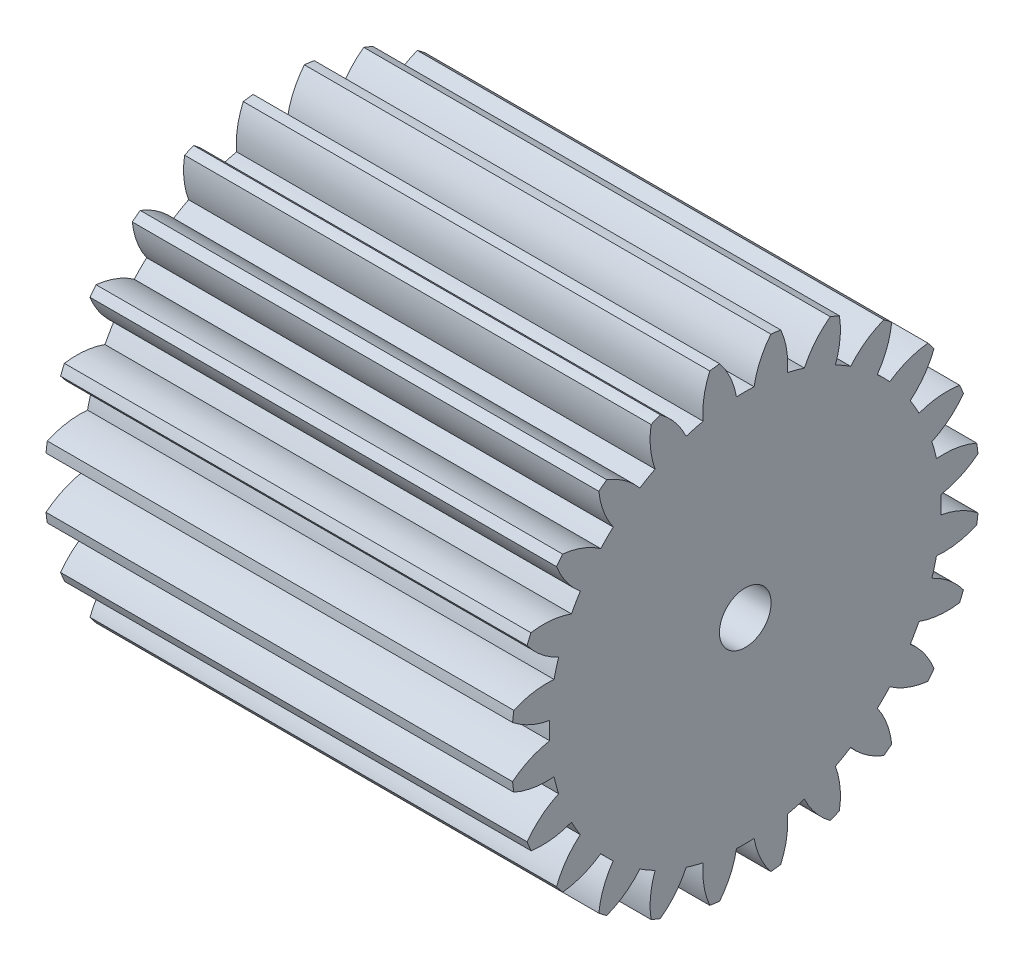
from build123d import *

# Parameters (mm, degrees)
SKETCH1_R           = 1.55
BOSS_EXTRUDE1_DEPTH = 28


with BuildPart() as part:
    # Sketch1 → Boss-Extrude1 (new body)
    with BuildSketch(Plane(origin=(-24.036200878, 0, 0), x_dir=(0, 0, -1), z_dir=(1, 0, 0))):
        with BuildLine():
            ThreePointArc((-20.45966069, 14.943685115), (-19.408744482, 14.297932757), (-18.23009109, 13.93434348))
            ThreePointArc((-18.23009109, 13.93434348), (-18.241981361, 13.405873993), (-18.23009109, 12.877404505))
            ThreePointArc((-18.23009109, 12.877404505), (-19.408744482, 12.513815228), (-20.45966069, 11.86806287))
            ThreePointArc((-20.45966069, 11.86806287), (-20.423843041, 11.571709606), (-20.381738364, 11.276184046))
            ThreePointArc((-20.381738364, 11.276184046), (-19.19949825, 10.924432295), (-17.966902668, 10.878289967))
            ThreePointArc((-17.966902668, 10.878289967), (-17.84160982, 10.364750213), (-17.693346732, 9.857365315))
            ThreePointArc((-17.693346732, 9.857365315), (-18.737734654, 9.201107096), (-19.585708752, 8.305361087))
            ThreePointArc((-19.585708752, 8.305361087), (-19.465117023, 8.00599622), (-19.337681897, 7.709479816))
            ThreePointArc((-19.337681897, 7.709479816), (-18.111776725, 7.700053845), (-16.921717322, 7.994487129))
            ThreePointArc((-16.921717322, 7.994487129), (-16.667779856, 7.530873993), (-16.393247835, 7.079151127))
            ThreePointArc((-16.393247835, 7.079151127), (-17.232196976, 6.17494688), (-17.81944093, 5.09025083))
            ThreePointArc((-17.81944093, 5.09025083), (-17.640245305, 4.851510199), (-17.456018805, 4.616629895))
            ThreePointArc((-17.456018805, 4.616629895), (-16.256292957, 4.903124001), (-15.165762707, 5.479461363))
            ThreePointArc((-15.165762707, 5.479461363), (-14.80048604, 5.097369314), (-14.418393991, 4.732092647))
            ThreePointArc((-14.418393991, 4.732092647), (-14.994731353, 3.641562397), (-15.281225459, 2.441836549))
            ThreePointArc((-15.281225459, 2.441836549), (-15.046345155, 2.257610049), (-14.807604524, 2.078414424))
            ThreePointArc((-14.807604524, 2.078414424), (-13.722908474, 2.665658378), (-12.818704227, 3.504607519))
            ThreePointArc((-12.818704227, 3.504607519), (-12.366981361, 3.230075498), (-11.903368225, 2.976138032))
            ThreePointArc((-11.903368225, 2.976138032), (-12.17781737, 1.773599613), (-12.144037527, 0.540603301))
            ThreePointArc((-12.144037527, 0.540603301), (-11.869479248, 0.423445663), (-11.592494266, 0.312146602))
            ThreePointArc((-11.592494266, 0.312146602), (-10.696748258, 1.1601207), (-10.040490039, 2.204508622))
            ThreePointArc((-10.040490039, 2.204508622), (-9.533105141, 2.056245534), (-9.019565387, 1.930952686))
            ThreePointArc((-9.019565387, 1.930952686), (-8.973423058, 0.698357104), (-8.621671308, -0.48388301))
            ThreePointArc((-8.621671308, -0.48388301), (-8.326145748, -0.525987687), (-8.029792484, -0.561805336))
            ThreePointArc((-8.029792484, -0.561805336), (-7.384040126, 0.489110872), (-7.020450848, 1.667764264))
            ThreePointArc((-7.020450848, 1.667764264), (-6.491981361, 1.655873993), (-5.963511874, 1.667764264))
            ThreePointArc((-5.963511874, 1.667764264), (-5.599922596, 0.489110872), (-4.954170239, -0.561805336))
            ThreePointArc((-4.954170239, -0.561805336), (-4.657816975, -0.525987687), (-4.362291414, -0.48388301))
            ThreePointArc((-4.362291414, -0.48388301), (-4.010539664, 0.698357104), (-3.964397336, 1.930952686))
            ThreePointArc((-3.964397336, 1.930952686), (-3.450857581, 2.056245534), (-2.943472684, 2.204508622))
            ThreePointArc((-2.943472684, 2.204508622), (-2.287214465, 1.1601207), (-1.391468456, 0.312146602))
            ThreePointArc((-1.391468456, 0.312146602), (-1.114483475, 0.423445663), (-0.839925195, 0.540603301))
            ThreePointArc((-0.839925195, 0.540603301), (-0.806145353, 1.773599613), (-1.080594498, 2.976138032))
            ThreePointArc((-1.080594498, 2.976138032), (-0.616981361, 3.230075498), (-0.165258496, 3.504607519))
            ThreePointArc((-0.165258496, 3.504607519), (0.738945751, 2.665658378), (1.823641801, 2.078414424))
            ThreePointArc((1.823641801, 2.078414424), (2.062382432, 2.257610049), (2.297262736, 2.441836549))
            ThreePointArc((2.297262736, 2.441836549), (2.01076863, 3.641562397), (1.434431268, 4.732092647))
            ThreePointArc((1.434431268, 4.732092647), (1.816523318, 5.097369314), (2.181799984, 5.479461363))
            ThreePointArc((2.181799984, 5.479461363), (3.272330234, 4.903124001), (4.472056082, 4.616629895))
            ThreePointArc((4.472056082, 4.616629895), (4.656282582, 4.851510199), (4.835478208, 5.09025083))
            ThreePointArc((4.835478208, 5.09025083), (4.248234253, 6.17494688), (3.409285113, 7.079151127))
            ThreePointArc((3.409285113, 7.079151127), (3.683817133, 7.530873993), (3.9377546, 7.994487129))
            ThreePointArc((3.9377546, 7.994487129), (5.140293018, 7.720037984), (6.37328933, 7.753817827))
            ThreePointArc((6.37328933, 7.753817827), (6.490446969, 8.028376106), (6.601746029, 8.305361087))
            ThreePointArc((6.601746029, 8.305361087), (5.753771931, 9.201107096), (4.709384009, 9.857365315))
            ThreePointArc((4.709384009, 9.857365315), (4.857647098, 10.364750213), (4.982939945, 10.878289967))
            ThreePointArc((4.982939945, 10.878289967), (6.215535527, 10.924432295), (7.397775641, 11.276184046))
            ThreePointArc((7.397775641, 11.276184046), (7.439880319, 11.571709606), (7.475697967, 11.86806287))
            ThreePointArc((7.475697967, 11.86806287), (6.424781759, 12.513815228), (5.246128367, 12.877404505))
            ThreePointArc((5.246128367, 12.877404505), (5.258018639, 13.405873993), (5.246128367, 13.93434348))
            ThreePointArc((5.246128367, 13.93434348), (6.424781759, 14.297932757), (7.475697967, 14.943685115))
            ThreePointArc((7.475697967, 14.943685115), (7.439880319, 15.240038379), (7.397775641, 15.535563939))
            ThreePointArc((7.397775641, 15.535563939), (6.215535527, 15.88731569), (4.982939945, 15.933458018))
            ThreePointArc((4.982939945, 15.933458018), (4.857647098, 16.446997772), (4.709384009, 16.95438267))
            ThreePointArc((4.709384009, 16.95438267), (5.753771931, 17.610640889), (6.601746029, 18.506386898))
            ThreePointArc((6.601746029, 18.506386898), (6.490446969, 18.783371879), (6.37328933, 19.057930158))
            ThreePointArc((6.37328933, 19.057930158), (5.140293018, 19.091710001), (3.9377546, 18.817260856))
            ThreePointArc((3.9377546, 18.817260856), (3.683817133, 19.280873993), (3.409285113, 19.732596858))
            ThreePointArc((3.409285113, 19.732596858), (4.248234253, 20.636801105), (4.835478208, 21.721497155))
            ThreePointArc((4.835478208, 21.721497155), (4.656282582, 21.960237786), (4.472056082, 22.19511809))
            ThreePointArc((4.472056082, 22.19511809), (3.272330234, 21.908623984), (2.181799984, 21.332286622))
            ThreePointArc((2.181799984, 21.332286622), (1.816523318, 21.714378671), (1.434431268, 22.079655338))
            ThreePointArc((1.434431268, 22.079655338), (2.01076863, 23.170185588), (2.297262736, 24.369911436))
            ThreePointArc((2.297262736, 24.369911436), (2.062382432, 24.554137936), (1.823641801, 24.733333561))
            ThreePointArc((1.823641801, 24.733333561), (0.738945751, 24.146089607), (-0.165258496, 23.307140466))
            ThreePointArc((-0.165258496, 23.307140466), (-0.616981361, 23.581672487), (-1.080594498, 23.835609953))
            ThreePointArc((-1.080594498, 23.835609953), (-0.806145353, 25.038148372), (-0.839925195, 26.271144684))
            ThreePointArc((-0.839925195, 26.271144684), (-1.114483475, 26.388302322), (-1.391468456, 26.499601383))
            ThreePointArc((-1.391468456, 26.499601383), (-2.287214465, 25.651627285), (-2.943472684, 24.607239363))
            ThreePointArc((-2.943472684, 24.607239363), (-3.450857581, 24.755502451), (-3.964397336, 24.880795299))
            ThreePointArc((-3.964397336, 24.880795299), (-4.010539664, 26.113390881), (-4.362291414, 27.295630995))
            ThreePointArc((-4.362291414, 27.295630995), (-4.657816975, 27.337735672), (-4.954170239, 27.373553321))
            ThreePointArc((-4.954170239, 27.373553321), (-5.599922596, 26.322637113), (-5.963511874, 25.143983721))
            ThreePointArc((-5.963511874, 25.143983721), (-6.491981361, 25.155873993), (-7.020450848, 25.143983721))
            ThreePointArc((-7.020450848, 25.143983721), (-7.384040126, 26.322637113), (-8.029792484, 27.373553321))
            ThreePointArc((-8.029792484, 27.373553321), (-8.326145748, 27.337735672), (-8.621671308, 27.295630995))
            ThreePointArc((-8.621671308, 27.295630995), (-8.973423058, 26.113390881), (-9.019565387, 24.880795299))
            ThreePointArc((-9.019565387, 24.880795299), (-9.533105141, 24.755502451), (-10.040490039, 24.607239363))
            ThreePointArc((-10.040490039, 24.607239363), (-10.696748258, 25.651627285), (-11.592494266, 26.499601383))
            ThreePointArc((-11.592494266, 26.499601383), (-11.869479248, 26.388302322), (-12.144037527, 26.271144684))
            ThreePointArc((-12.144037527, 26.271144684), (-12.17781737, 25.038148372), (-11.903368225, 23.835609953))
            ThreePointArc((-11.903368225, 23.835609953), (-12.366981361, 23.581672487), (-12.818704227, 23.307140466))
            ThreePointArc((-12.818704227, 23.307140466), (-13.722908474, 24.146089607), (-14.807604524, 24.733333561))
            ThreePointArc((-14.807604524, 24.733333561), (-15.046345155, 24.554137936), (-15.281225459, 24.369911436))
            ThreePointArc((-15.281225459, 24.369911436), (-14.994731353, 23.170185588), (-14.418393991, 22.079655338))
            ThreePointArc((-14.418393991, 22.079655338), (-14.80048604, 21.714378671), (-15.165762707, 21.332286622))
            ThreePointArc((-15.165762707, 21.332286622), (-16.256292957, 21.908623984), (-17.456018805, 22.19511809))
            ThreePointArc((-17.456018805, 22.19511809), (-17.640245305, 21.960237786), (-17.81944093, 21.721497155))
            ThreePointArc((-17.81944093, 21.721497155), (-17.232196976, 20.636801105), (-16.393247835, 19.732596858))
            ThreePointArc((-16.393247835, 19.732596858), (-16.667779856, 19.280873993), (-16.921717322, 18.817260856))
            ThreePointArc((-16.921717322, 18.817260856), (-18.124255741, 19.091710001), (-19.357252053, 19.057930158))
            ThreePointArc((-19.357252053, 19.057930158), (-19.474409691, 18.783371879), (-19.585708752, 18.506386898))
            ThreePointArc((-19.585708752, 18.506386898), (-18.737734654, 17.610640889), (-17.693346732, 16.95438267))
            ThreePointArc((-17.693346732, 16.95438267), (-17.84160982, 16.446997772), (-17.966902668, 15.933458018))
            ThreePointArc((-17.966902668, 15.933458018), (-19.19949825, 15.88731569), (-20.381738364, 15.535563939))
            ThreePointArc((-20.381738364, 15.535563939), (-20.423843041, 15.240038379), (-20.45966069, 14.943685115))
        make_face()
        with Locations(Location((-6.491981361, 13.405873993, 0), (0, 0, 180))):
            Circle(SKETCH1_R, mode=Mode.SUBTRACT)
    extrude(amount=-BOSS_EXTRUDE1_DEPTH)


solid = part.part
